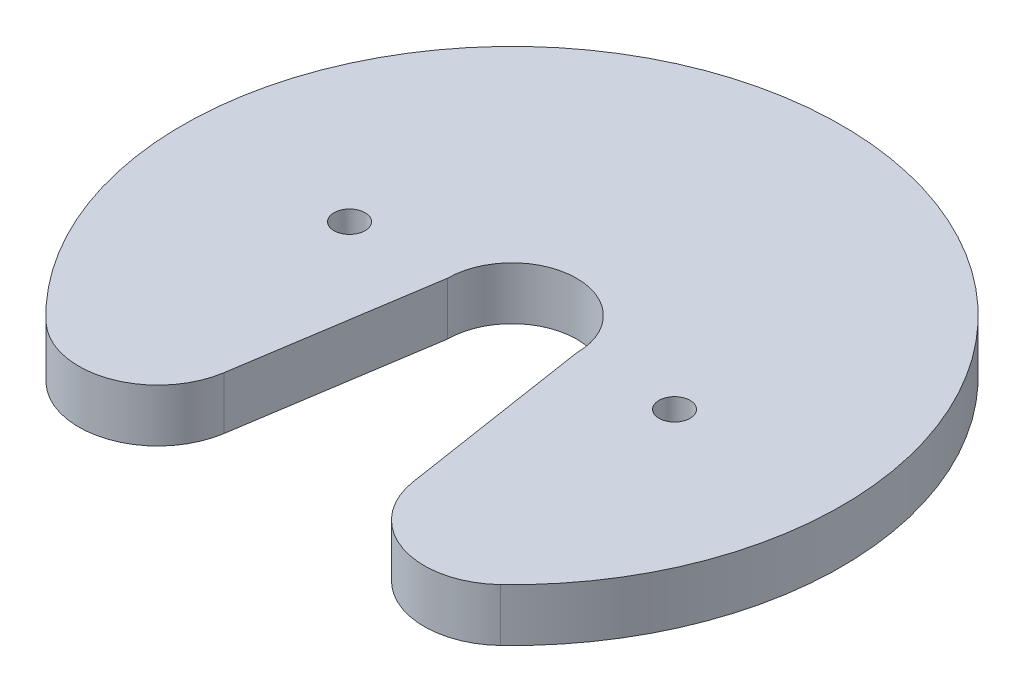
from build123d import *

# Parameters (mm, degrees)
SKETCH1_R           = 1.5
BOSS_EXTRUDE1_DEPTH = 5.08


with BuildPart() as part:
    # Sketch1 → Boss-Extrude1 (new body)
    with BuildSketch(Plane(origin=(0, 0, 0), x_dir=(1, 0, 0), z_dir=(0, 1, 0))):
        with BuildLine():
            Line((6.223, 0), (9.106543772, -18.642408089))
            ThreePointArc((9.106543772, -18.642408089), (14.180138014, -24.690685628), (21.89078133, -22.996873543))
            ThreePointArc((21.89078133, -22.996873543), (0, 31.75), (-21.89078133, -22.996873543))
            ThreePointArc((-21.89078133, -22.996873543), (-14.180138014, -24.690685628), (-9.106543772, -18.642408089))
            Line((-9.106543772, -18.642408089), (-6.223, 0))
            ThreePointArc((-6.223, 0), (0, 6.223), (6.223, 0))
        make_face()
        with Locations(Location((15.65097218, 0, 0), (0, 0, 270))):
            Circle(SKETCH1_R, mode=Mode.SUBTRACT)
        with Locations(Location((-15.65097218, 0, 0), (0, 0, 90))):
            Circle(SKETCH1_R, mode=Mode.SUBTRACT)
    extrude(amount=BOSS_EXTRUDE1_DEPTH)


solid = part.part
